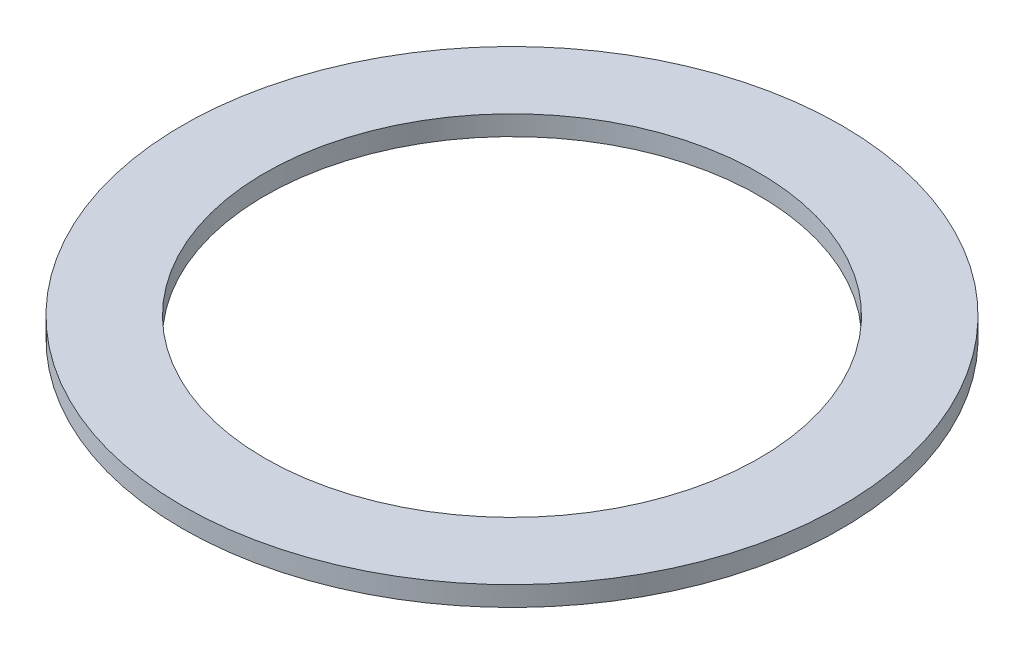
from build123d import *

# Parameters (mm, degrees)
SKETCH1_W = 1.5875
SKETCH1_H = 0.381


with BuildPart() as part:
    # Sketch1 → Revolve1 (revolve)
    with BuildSketch(Plane(origin=(0, 0, 0), x_dir=(0, 0, -1), z_dir=(1, 0, 0)), mode=Mode.PRIVATE) as revolve1_sk:
        with Locations((5.55625, 0)):
            Rectangle(SKETCH1_W, SKETCH1_H)
    revolve(revolve1_sk.sketch.rotate(Axis((0, 14.286213682, 0), (0, -1, 0)), 180), axis=Axis((0, 14.286213682, 0), (0, -1, 0)))


solid = part.part
